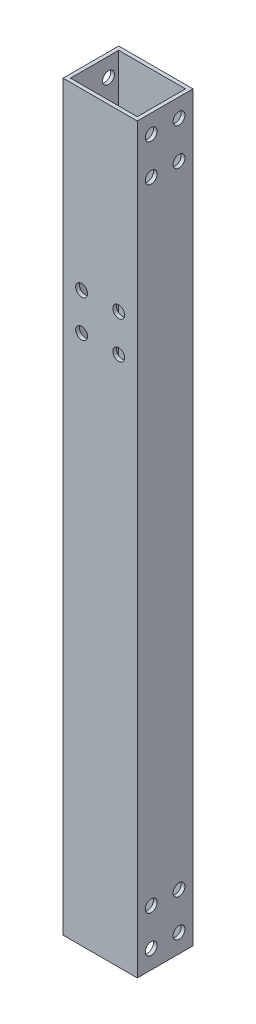
from build123d import *

# Parameters (mm, degrees)
SKETCH_1_W          = 20
SKETCH_1_H          = 15
SKETCH_1_W_2        = 18
SKETCH_1_H_2        = 13
EXTRUDE_1_DEPTH     = 200
SKETCH_3_R          = 1.6
CUT_EXTRUDE_1_DEPTH = 201.81085628
SKETCH_4_R          = 1.6
CUT_EXTRUDE_2_DEPTH = 202.137390855


with BuildPart() as part:
    # 草图1 → 拉伸-薄壁1 (new body)
    with BuildSketch(Plane(origin=(0, 0, 0), x_dir=(1, 0, 0), z_dir=(0, 1, 0))):
        Rectangle(SKETCH_1_W, SKETCH_1_H)
        Rectangle(SKETCH_1_W_2, SKETCH_1_H_2, mode=Mode.SUBTRACT)
    extrude(amount=EXTRUDE_1_DEPTH)

    # 草图3 → 切除-拉伸1 (cut, through all)
    with BuildSketch(Plane.XY.offset(7.5)):
        with Locations((-5, 153)):
            Circle(SKETCH_3_R)
        with Locations(Location((-5, 143, 0), (0, 0, 180))):
            Circle(SKETCH_3_R)
        with Locations((5, 143)):
            Circle(SKETCH_3_R)
        with Locations(Location((5, 153, 0), (0, 0, 180))):
            Circle(SKETCH_3_R)
    extrude(amount=-CUT_EXTRUDE_1_DEPTH, mode=Mode.SUBTRACT)

    # 草图4 → 切除-拉伸2 (cut, through all)
    with BuildSketch(Plane(origin=(10, 0, 0), x_dir=(0, 0, -1), z_dir=(1, 0, 0))):
        with Locations((-3.75, 5)):
            Circle(SKETCH_4_R)
        with Locations((-3.75, 15)):
            Circle(SKETCH_4_R)
        with Locations((3.75, 5)):
            Circle(SKETCH_4_R)
        with Locations((3.75, 15)):
            Circle(SKETCH_4_R)
        with Locations((3.75, 185)):
            Circle(SKETCH_4_R)
        with Locations((3.75, 195)):
            Circle(SKETCH_4_R)
        with Locations((-3.75, 185)):
            Circle(SKETCH_4_R)
        with Locations((-3.75, 195)):
            Circle(SKETCH_4_R)
    extrude(amount=-CUT_EXTRUDE_2_DEPTH, mode=Mode.SUBTRACT)


solid = part.part
